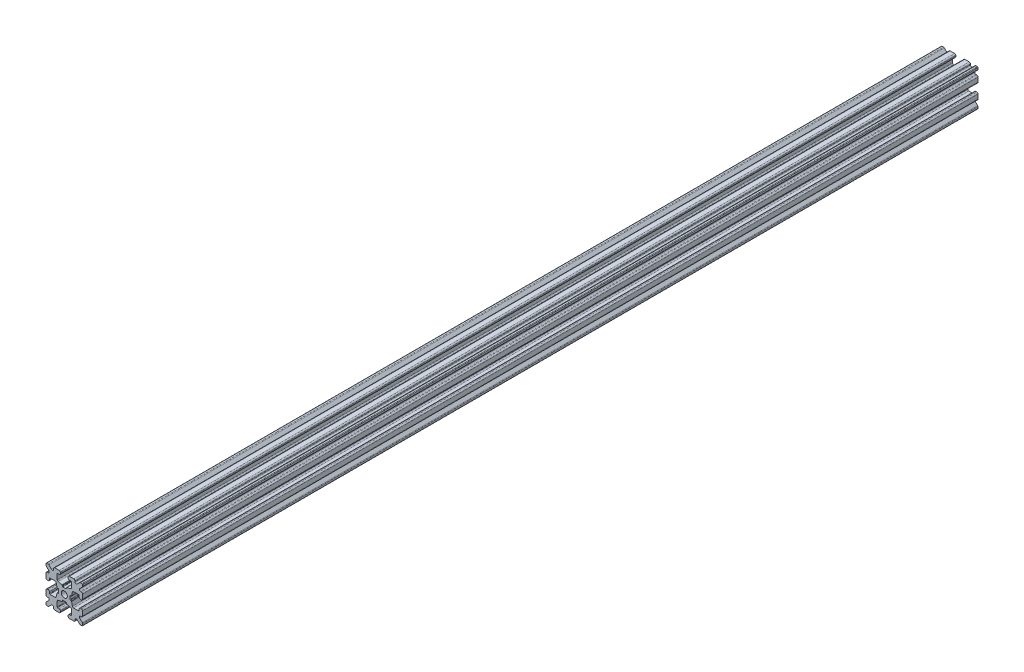
from build123d import *

# Parameters (mm, degrees)
SKETCH1_W           = 15
SKETCH1_H           = 15
SKETCH1_R           = 1.25
BOSS_EXTRUDE1_DEPTH = 183.5
FILLET1_R           = 0.25
CUT_EXTRUDE1_DEPTH  = 368.153237763
CUT_EXTRUDE3_DEPTH  = 368.153237763
FILLET3_R           = 0.5
FILLET4_R           = 0.5
FILLET5_R           = 3
FILLET6_R           = 0.2
CUT_EXTRUDE4_DEPTH  = 368.153237763
FILLET8_R           = 0.5
SKETCH6_W           = 5.1529354
SKETCH6_H           = 1.651
SKETCH6_W_2         = 1.651
SKETCH6_H_2         = 5.1529354
CUT_EXTRUDE5_DEPTH  = 368.153237763
FILLET10_R          = 0.2


with BuildPart() as part:
    # Sketch1 → Boss-Extrude1 (new, symmetric)
    with BuildSketch(Plane.XY):
        Rectangle(SKETCH1_W, SKETCH1_H)
        Circle(SKETCH1_R, mode=Mode.SUBTRACT)
    extrude(amount=BOSS_EXTRUDE1_DEPTH, both=True)

    # Fillet1
    fillet1_edges = [part.edges().sort_by_distance(p)[0] for p in [
        (7.5, -7.5, 0),
        (-7.5, -7.5, 0),
        (-7.5, 7.5, 0),
        (7.5, 7.5, 0),
    ]]
    fillet(fillet1_edges, radius=FILLET1_R)

    # Sketch2 → Cut-Extrude1 (cut, through all)
    with BuildSketch(Plane.XY.offset(183.5)):
        Polygon((-7.5, 1.6), (-6.1, 1.6), (-6.1, 2.9), (-3.4, 2.9), (-3.4, -2.9), (-6.1, -2.9), (-6.1, -1.6), (-7.5, -1.6), align=None)
        Polygon((2.9, 6.1), (1.6, 6.1), (1.6, 7.5), (-1.6, 7.5), (-1.6, 6.1), (-2.9, 6.1), (-2.9, 3.4), (2.9, 3.4), align=None)
        Polygon((-1.6, -7.5), (-1.6, -6.1), (-2.9, -6.1), (-2.9, -3.4), (2.9, -3.4), (2.9, -6.1), (1.6, -6.1), (1.6, -7.5), align=None)
        Polygon((6.1, -2.9), (6.1, -1.6), (7.5, -1.6), (7.5, 1.6), (6.1, 1.6), (6.1, 2.9), (3.4, 2.9), (3.4, -2.9), align=None)
    extrude(amount=-CUT_EXTRUDE1_DEPTH, mode=Mode.SUBTRACT)

    # Sketch4 → Cut-Extrude3 (cut, through all)
    with BuildSketch(Plane.XY.offset(183.5)):
        Polygon((-3.4, 2.9), (-2.75, 0), (-3.4, -2.9), align=None)
        Polygon((-2.9, 3.4), (0, 2.75), (2.9, 3.4), align=None)
        Polygon((3.4, 2.9), (2.75, 0), (3.4, -2.9), align=None)
        Polygon((-2.9, -3.4), (0, -2.75), (2.9, -3.4), align=None)
    extrude(amount=-CUT_EXTRUDE3_DEPTH, mode=Mode.SUBTRACT)

    # Fillet3
    fillet3_edges = [part.edges().sort_by_distance(p)[0] for p in [
        (1.6, -7.5, 0),
        (-1.6, -7.5, 0),
        (-1.6, -6.1, 0),
        (1.6, -6.1, 0),
        (6.1, 1.6, 0),
        (7.5, 1.6, 0),
        (7.5, -1.6, 0),
        (6.1, -1.6, 0),
        (-7.5, -1.6, 0),
        (-7.5, 1.6, 0),
        (-6.1, 1.6, 0),
        (-6.1, -1.6, 0),
        (-1.6, 6.1, 0),
        (-1.6, 7.5, 0),
        (1.6, 7.5, 0),
        (1.6, 6.1, 0),
    ]]
    fillet(fillet3_edges, radius=FILLET3_R)

    # Fillet4
    fillet4_edges = [part.edges().sort_by_distance(p)[0] for p in [
        (-2.9, -3.4, 0),
        (2.9, -3.4, 0),
        (3.4, -2.9, 0),
        (3.4, 2.9, 0),
        (-3.4, 2.9, 0),
        (-3.4, -2.9, 0),
        (2.9, 3.4, 0),
        (-2.9, 3.4, 0),
    ]]
    fillet(fillet4_edges, radius=FILLET4_R)

    # Fillet5
    fillet5_edges = [part.edges().sort_by_distance(p)[0] for p in [
        (-2.75, 0, 0),
        (0, 2.75, 0),
        (2.75, 0, 0),
        (0, -2.75, 0),
    ]]
    fillet(fillet5_edges, radius=FILLET5_R)

    # Fillet6
    fillet6_edges = [part.edges().sort_by_distance(p)[0] for p in [
        (-2.9, -6.1, 0),
        (2.9, -6.1, 0),
        (6.1, -2.9, 0),
        (6.1, 2.9, 0),
        (-6.1, 2.9, 0),
        (-6.1, -2.9, 0),
        (2.9, 6.1, 0),
        (-2.9, 6.1, 0),
    ]]
    fillet(fillet6_edges, radius=FILLET6_R)

    # Sketch5 → Cut-Extrude4 (cut, through all)
    with BuildSketch(Plane.XY.offset(183.5)):
        Polygon((-7.5, 6.439339828), (-5.460660172, 4.4), (-7.5, 4.4), align=None)
        Polygon((-6.439339828, 7.5), (-4.4, 5.460660172), (-4.4, 7.5), align=None)
        Polygon((4.4, 7.5), (6.439339828, 7.5), (4.4, 5.460660172), align=None)
        Polygon((7.5, 6.439339828), (7.5, 4.4), (5.460660172, 4.4), align=None)
        Polygon((7.5, -6.439339828), (5.460660172, -4.4), (7.5, -4.4), align=None)
        Polygon((6.439339828, -7.5), (4.4, -5.460660172), (4.4, -7.5), align=None)
        Polygon((-4.4, -7.5), (-6.439339828, -7.5), (-4.4, -5.460660172), align=None)
        Polygon((-7.5, -6.439339828), (-7.5, -4.4), (-5.460660172, -4.4), align=None)
    extrude(amount=-CUT_EXTRUDE4_DEPTH, mode=Mode.SUBTRACT)

    # Fillet8
    fillet8_edges = [part.edges().sort_by_distance(p)[0] for p in [
        (-7.5, 4.4, 0),
        (-7.5, 6.439339828, 0),
        (-5.460660172, 4.4, 0),
        (7.5, -4.4, 0),
        (7.5, -6.439339828, 0),
        (5.460660172, -4.4, 0),
        (5.460660172, 4.4, 0),
        (7.5, 6.439339828, 0),
        (7.5, 4.4, 0),
        (-4.4, 7.5, 0),
        (-4.4, 5.460660172, 0),
        (-6.439339828, 7.5, 0),
        (-5.460660172, -4.4, 0),
        (-7.5, -6.439339828, 0),
        (-7.5, -4.4, 0),
        (4.4, 5.460660172, 0),
        (4.4, 7.5, 0),
        (6.439339828, 7.5, 0),
        (6.439339828, -7.5, 0),
        (4.4, -7.5, 0),
        (4.4, -5.460660172, 0),
        (-6.439339828, -7.5, 0),
        (-4.4, -5.460660172, 0),
        (-4.4, -7.5, 0),
    ]]
    fillet(fillet8_edges, radius=FILLET8_R)

    # Sketch6 → Cut-Extrude5 (cut, through all)
    with BuildSketch(Plane.XY.offset(183.5)):
        with Locations((4.9235323, 0)):
            Rectangle(SKETCH6_W, SKETCH6_H)
        with Locations((0, -4.9235323)):
            Rectangle(SKETCH6_W_2, SKETCH6_H_2)
        with Locations((-4.9235323, 0)):
            Rectangle(SKETCH6_W, SKETCH6_H)
        with Locations((0, 4.9235323)):
            Rectangle(SKETCH6_W_2, SKETCH6_H_2)
    extrude(amount=-CUT_EXTRUDE5_DEPTH, mode=Mode.SUBTRACT)

    # Fillet10
    fillet10_edges = [part.edges().sort_by_distance(p)[0] for p in [
        (0.8255, -2.935025862, 0),
        (-0.8255, -2.935025862, 0),
        (0.8255, -2.3470646, 0),
        (-0.8255, -2.3470646, 0),
        (2.935025862, 0.8255, 0),
        (2.935025862, -0.8255, 0),
        (2.3470646, 0.8255, 0),
        (2.3470646, -0.8255, 0),
        (-2.935025862, -0.8255, 0),
        (-2.935025862, 0.8255, 0),
        (-2.3470646, -0.8255, 0),
        (-2.3470646, 0.8255, 0),
        (-0.8255, 2.935025862, 0),
        (0.8255, 2.935025862, 0),
        (-0.8255, 2.3470646, 0),
        (0.8255, 2.3470646, 0),
    ]]
    fillet(fillet10_edges, radius=FILLET10_R)


solid = part.part
